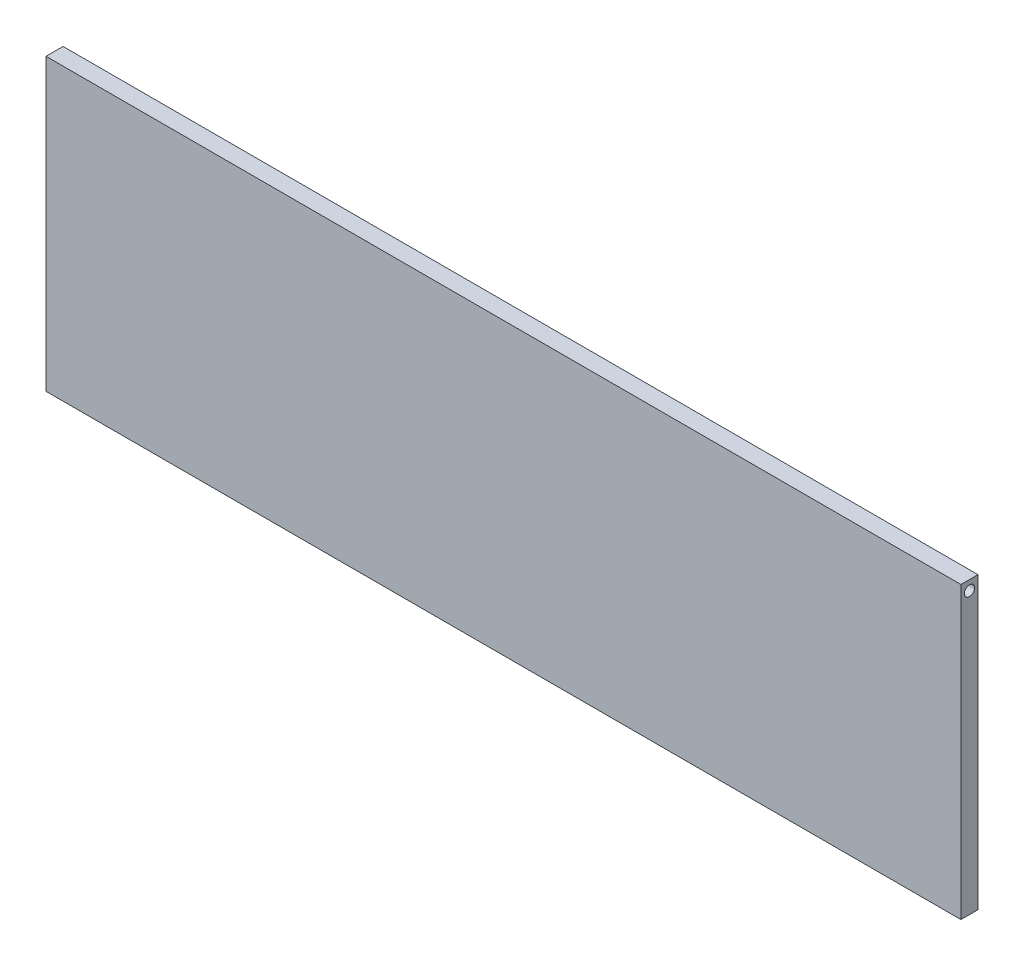
from build123d import *

# Parameters (mm, degrees)
SKETCH1_W           = 268
SKETCH1_H           = 85
BOSS_EXTRUDE1_DEPTH = 5
SKETCH2_R           = 1.5
CUT_EXTRUDE1_DEPTH  = 273.178159475


with BuildPart() as part:
    # Sketch1 → Boss-Extrude1 (new body)
    with BuildSketch(Plane.XY):
        with Locations((-27.823834197, 4.743523316)):
            Rectangle(SKETCH1_W, SKETCH1_H)
    extrude(amount=BOSS_EXTRUDE1_DEPTH)

    # Sketch2 → Cut-Extrude1 (cut, through all)
    with BuildSketch(Plane(origin=(106.176165803, 0, 0), x_dir=(0, 0, -1), z_dir=(1, 0, 0))):
        with Locations((-2.5, 44.420616861)):
            Circle(SKETCH2_R)
    extrude(amount=-CUT_EXTRUDE1_DEPTH, mode=Mode.SUBTRACT)


solid = part.part
